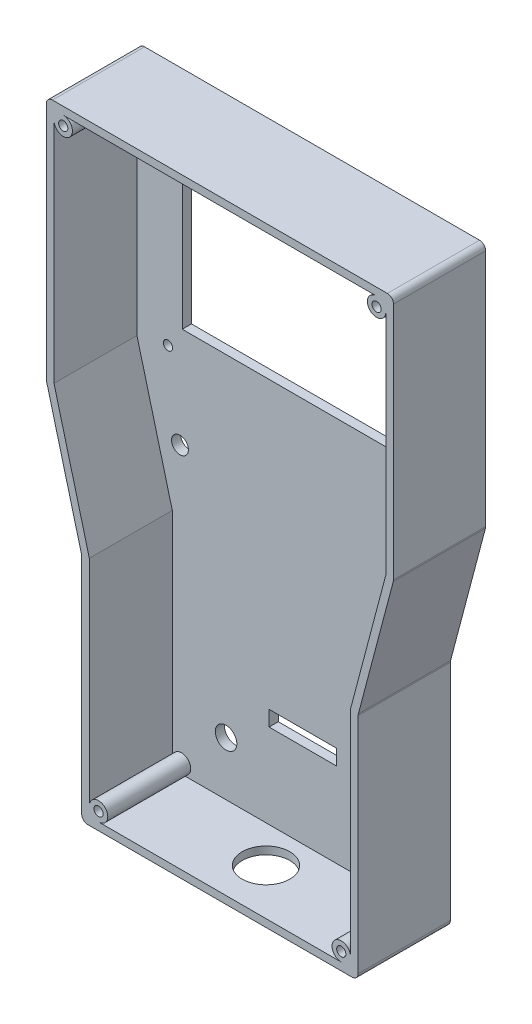
from build123d import *

# Parameters (mm, degrees)
SKETCH1_R           = 3.5
SKETCH1_R_2         = 2.75
SKETCH1_W           = 22
SKETCH1_H           = 5
SKETCH1_R_3         = 1.5
BOSS_EXTRUDE1_DEPTH = 30
CUT_EXTRUDE2_DEPTH  = 27
CUT_EXTRUDE4_DEPTH  = 1
FILLET1_R           = 2
BOSS_EXTRUDE2_DEPTH = 27
SKETCH6_R           = 1.5
CUT_EXTRUDE5_DEPTH  = 20
CUT_EXTRUDE6_REACH  = 210.53
SKETCH7_R           = 7.75


with BuildPart() as part:
    # Sketch1 → Boss-Extrude1 (new body)
    with BuildSketch(Plane.XY):
        Polygon((56.5, 44.975), (-56.5, 44.975), (-56.5, -34.975), (-45, -78.5), (-45, -153.5), (45, -153.5), (45, -78.5), (56.5, -34.975), align=None)
        with Locations((-25, -133.5)):
            Circle(SKETCH1_R, mode=Mode.SUBTRACT)
        with Locations((-40, -58.5)):
            Circle(SKETCH1_R_2, mode=Mode.SUBTRACT)
        with Locations((0, -121)):
            Rectangle(SKETCH1_W, SKETCH1_H, mode=Mode.SUBTRACT)
        with Locations((25, -133.5)):
            Circle(SKETCH1_R_2, mode=Mode.SUBTRACT)
        with Locations((40, -58.5)):
            Circle(SKETCH1_R_2, mode=Mode.SUBTRACT)
        with Locations((-43.9, -32.375)):
            Circle(SKETCH1_R_3, mode=Mode.SUBTRACT)
        with Locations((-43.9, 32.375)):
            Circle(SKETCH1_R_3, mode=Mode.SUBTRACT)
        with Locations((43.9, -32.375)):
            Circle(SKETCH1_R_3, mode=Mode.SUBTRACT)
        Polygon((-39.25, -25.5), (-39.25, 25.5), (39.25, 25.5), (39.25, 21.45), (43.95, 21.45), (43.95, -21.45), (39.25, -21.45), (39.25, -25.5), align=None, mode=Mode.SUBTRACT)
        with Locations((43.9, 32.375)):
            Circle(SKETCH1_R_3, mode=Mode.SUBTRACT)
    extrude(amount=BOSS_EXTRUDE1_DEPTH)

    # Sketch2 → Cut-Extrude2 (cut)
    with BuildSketch(Plane.XY.offset(30)):
        Polygon((54, 42.475), (54, -34.65030126), (42.5, -78.17530126), (42.5, -151), (-42.5, -151), (-42.5, -78.17530126), (-54, -34.65030126), (-54, 42.475), align=None)
    extrude(amount=-CUT_EXTRUDE2_DEPTH, mode=Mode.SUBTRACT)

    # Sketch1<3> → Cut-Extrude4 (cut)
    with BuildSketch(Plane.XY):
        with BuildLine():
            Line((-28, -118.5), (28, -118.5))
            ThreePointArc((28, -118.5), (32.949747468, -116.449747468), (35, -111.5))
            Line((35, -111.5), (35, -45.5))
            ThreePointArc((35, -45.5), (32.949747468, -40.550252532), (28, -38.5))
            Line((28, -38.5), (-28, -38.5))
            ThreePointArc((-28, -38.5), (-32.949747468, -40.550252532), (-35, -45.5))
            Line((-35, -45.5), (-35, -111.5))
            ThreePointArc((-35, -111.5), (-32.949747468, -116.449747468), (-28, -118.5))
        make_face()
    extrude(amount=CUT_EXTRUDE4_DEPTH, mode=Mode.SUBTRACT)

    # Fillet1
    fillet1_edges = [part.edges().sort_by_distance(p)[0] for p in [
        (56.5, 44.975, 15),
        (56.5, -34.975, 15),
        (45, -78.5, 15),
        (45, -153.5, 15),
        (-45, -153.5, 15),
        (-45, -78.5, 15),
        (-56.5, -34.975, 15),
        (-56.5, 44.975, 15),
    ]]
    fillet(fillet1_edges, radius=FILLET1_R)

    # Sketch5 → Boss-Extrude2 (add, through all)
    with BuildSketch(Plane.XY.offset(3)):
        with BuildLine():
            Line((-42.5, -151), (-42.5, -148))
            ThreePointArc((-42.5, -148), (-37.378679656, -145.878679656), (-39.5, -151))
            Line((-39.5, -151), (-42.5, -151))
        make_face()
        with BuildLine():
            Line((39.5, -151), (42.5, -151))
            Line((42.5, -151), (42.5, -148))
            ThreePointArc((42.5, -148), (37.378679656, -145.878679656), (39.5, -151))
        make_face()
        with BuildLine():
            Line((-54, 42.475), (-51, 42.475))
            ThreePointArc((-51, 42.475), (-48.878679656, 37.353679656), (-54, 39.475))
            Line((-54, 39.475), (-54, 42.475))
        make_face()
        with BuildLine():
            Line((54, 39.475), (54, 42.475))
            Line((54, 42.475), (51, 42.475))
            ThreePointArc((51, 42.475), (48.878679656, 37.353679656), (54, 39.475))
        make_face()
    extrude(amount=BOSS_EXTRUDE2_DEPTH)

    # Sketch6 → Cut-Extrude5 (cut)
    with BuildSketch(Plane.XY.offset(30)):
        with Locations((51, 39.475)):
            Circle(SKETCH6_R)
        with Locations((39.5, -148)):
            Circle(SKETCH6_R)
        with Locations(Location((-39.5, -148, 0), (0, 0, 180))):
            Circle(SKETCH6_R)
        with Locations(Location((-51, 39.475, 0), (0, 0, 180))):
            Circle(SKETCH6_R)
    extrude(amount=-CUT_EXTRUDE5_DEPTH, mode=Mode.SUBTRACT)

    # Sketch7 → Cut-Extrude6 (cut, up to next)
    with BuildSketch(Plane.XZ.offset(153.5), mode=Mode.PRIVATE) as cut_extrude6_sk1:
        with Locations(Location((0, 15, 0), (0, 0, 270))):
            Circle(SKETCH7_R)
    cut_extrude6_tool1 = extrude(cut_extrude6_sk1.sketch, amount=-CUT_EXTRUDE6_REACH, mode=Mode.PRIVATE) & part.part
    add(cut_extrude6_tool1.solids().sort_by_distance((0, -153.5, 15))[0], mode=Mode.SUBTRACT)


solid = part.part
